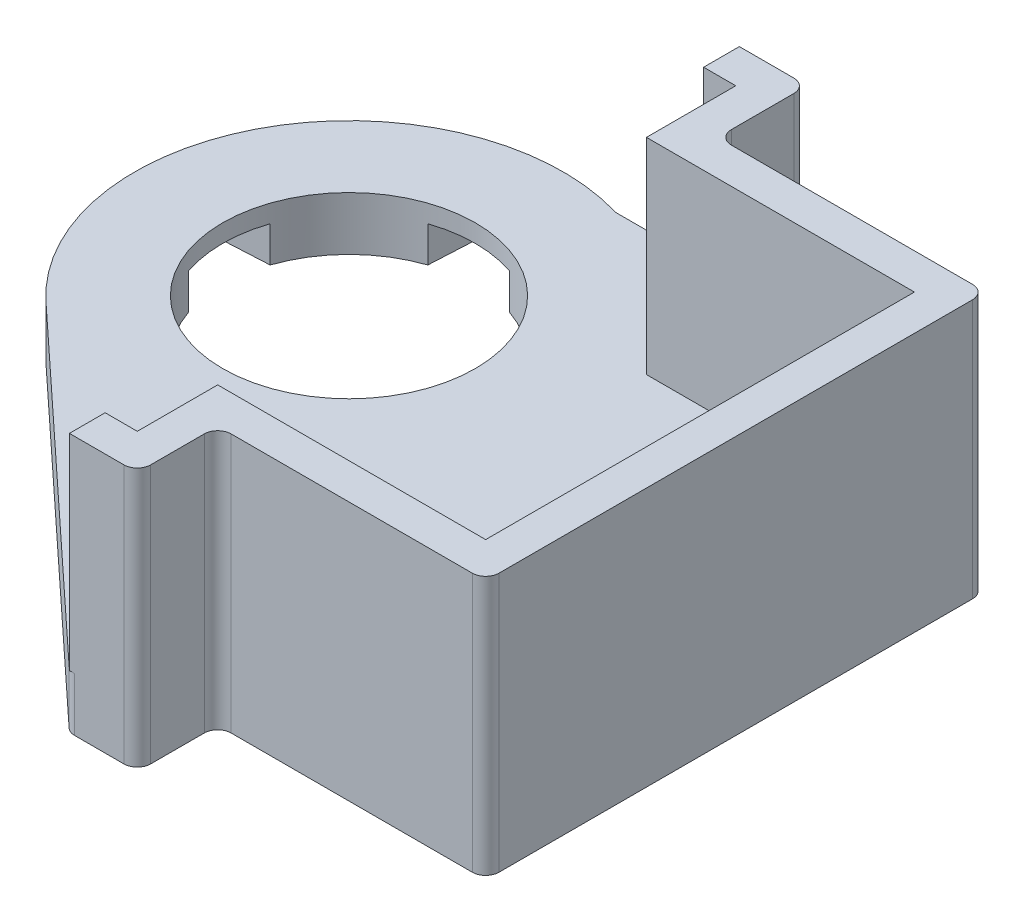
from build123d import *

# Parameters (mm, degrees)
BRACKET_DEPTH       = 11.5
BOSS_EXTRUDE1_START = -3
BOSS_EXTRUDE1_DEPTH = 3
CUT_EXTRUDE1_START  = -3
CUT_EXTRUDE1_DEPTH  = 2
CUT_EXTRUDE2_START  = -2.5
SKETCH15_4_W        = 5
SKETCH15_4_H        = 5
CUT_EXTRUDE2_DEPTH  = 2.5


with BuildPart() as part:
    # Sketch9 → Bracket (new body)
    with BuildSketch(Plane(origin=(0, 0, 0), x_dir=(1, 0, 0), z_dir=(0, 1, 0))):
        with BuildLine():
            Line((5.15, -5), (4.65, -5))
            Line((4.65, -5), (3.35, -5))
            Line((3.35, -5), (3.35, -7))
            Line((3.35, -7), (6.4, -7))
            ThreePointArc((6.4, -7), (6.930330086, -6.780330086), (7.15, -6.25))
            Line((7.15, -6.25), (7.15, -5))
            Line((7.15, -5), (7.15, -3.25))
            ThreePointArc((7.15, -3.25), (7.369669914, -2.719669914), (7.9, -2.5))
            Line((7.9, -2.5), (21.4, -2.5))
            ThreePointArc((21.4, -2.5), (21.930330086, -2.280330086), (22.15, -1.75))
            Line((22.15, -1.75), (22.15, 24.75))
            ThreePointArc((22.15, 24.75), (21.930330086, 25.280330086), (21.4, 25.5))
            Line((21.4, 25.5), (7.9, 25.5))
            ThreePointArc((7.9, 25.5), (7.369669914, 25.719669914), (7.15, 26.25))
            Line((7.15, 26.25), (7.15, 28))
            Line((7.15, 28), (7.15, 29.75))
            ThreePointArc((7.15, 29.75), (6.930330086, 30.280330086), (6.4, 30.5))
            Line((6.4, 30.5), (5.15, 30.5))
            Line((5.15, 30.5), (3.35, 30.5))
            Line((3.35, 30.5), (3.35, 28.5))
            Line((3.35, 28.5), (5.15, 28.5))
            Line((5.15, 28.5), (5.15, 28))
            Line((5.15, 28), (5.15, 23.5))
            Line((5.15, 23.5), (20.15, 23.5))
            Line((20.15, 23.5), (20.15, -0.5))
            Line((20.15, -0.5), (5.15, -0.5))
            Line((5.15, -0.5), (5.15, -5))
        make_face()
    extrude(amount=BRACKET_DEPTH)

    # Sketch12 → Boss-Extrude1 (add)
    with BuildSketch(Plane(origin=(0, 0, 0), x_dir=(1, 0, 0), z_dir=(0, 1, 0)).offset(BOSS_EXTRUDE1_START)):
        with BuildLine():
            Line((3.134136634, -6.799408153), (-15.169112008, 10.208954707))
            ThreePointArc((-15.169112008, 10.208954707), (-17.445237733, 24.907700028), (-3.6745965, 30.529381479))
            ThreePointArc((-3.6745965, 30.529381479), (-3.571695801, 30.507381696), (-3.466728879, 30.5))
            Line((-3.466728879, 30.5), (6.4, 30.5))
            ThreePointArc((6.4, 30.5), (6.930330086, 30.280330086), (7.15, 29.75))
            Line((7.15, 29.75), (7.15, 26.25))
            ThreePointArc((7.15, 26.25), (7.369669914, 25.719669914), (7.9, 25.5))
            Line((7.9, 25.5), (21.4, 25.5))
            ThreePointArc((21.4, 25.5), (21.930330086, 25.280330086), (22.15, 24.75))
            Line((22.15, 24.75), (22.15, -1.75))
            ThreePointArc((22.15, -1.75), (21.930330086, -2.280330086), (21.4, -2.5))
            Line((21.4, -2.5), (7.9, -2.5))
            ThreePointArc((7.9, -2.5), (7.369669914, -2.719669914), (7.15, -3.25))
            Line((7.15, -3.25), (7.15, -6.25))
            ThreePointArc((7.15, -6.25), (6.930330086, -6.780330086), (6.4, -7))
            Line((6.4, -7), (3.644676233, -7))
            ThreePointArc((3.644676233, -7), (3.370410043, -6.948053048), (3.134136634, -6.799408153))
        make_face()
    extrude(amount=BOSS_EXTRUDE1_DEPTH)

    # Sketch15 → Cut-Extrude1 (cut)
    with BuildSketch(Plane(origin=(0, 0, 0), x_dir=(1, 0, 0), z_dir=(0, 1, 0)).offset(CUT_EXTRUDE1_START)):
        with BuildLine():
            Line((-9.279054633, 12.306278316), (-8.999521572, 7.000514852))
            ThreePointArc((-8.999521572, 7.000514852), (-6.999521572, 5.000514852), (-4.999521572, 7.000514852))
            Line((-4.999521572, 7.000514852), (-4.720515244, 12.306424778))
            ThreePointArc((-4.720515244, 12.306424778), (-1.999839357, 14.000160648), (-0.306278316, 16.720945367))
            Line((-0.306278316, 16.720945367), (4.999485148, 17.000478428))
            ThreePointArc((4.999485148, 17.000478428), (6.999485148, 19.000478428), (4.999485148, 21.000478428))
            Line((4.999485148, 21.000478428), (-0.306424778, 21.279484756))
            ThreePointArc((-0.306424778, 21.279484756), (-2.000160648, 24.000160643), (-4.720945367, 25.693721684))
            Line((-4.720945367, 25.693721684), (-5.000478428, 30.999485148))
            ThreePointArc((-5.000478428, 30.999485148), (-7.000478428, 32.999485148), (-9.000478428, 30.999485148))
            Line((-9.000478428, 30.999485148), (-9.279484756, 25.693575222))
            ThreePointArc((-9.279484756, 25.693575222), (-12.000160643, 23.999839352), (-13.693721684, 21.279054633))
            Line((-13.693721684, 21.279054633), (-18.999485148, 20.999521572))
            ThreePointArc((-18.999485148, 20.999521572), (-20.999485148, 18.999521572), (-18.999485148, 16.999521572))
            Line((-18.999485148, 16.999521572), (-13.693575222, 16.720515244))
            ThreePointArc((-13.693575222, 16.720515244), (-11.999839352, 13.999839357), (-9.279054633, 12.306278316))
        make_face()
    extrude(amount=CUT_EXTRUDE1_DEPTH, mode=Mode.SUBTRACT)

    # Sketch15<4> → Cut-Extrude2 (cut)
    with BuildSketch(Plane(origin=(0, 0, 0), x_dir=(1, 0, 0), z_dir=(0, 1, 0)).offset(CUT_EXTRUDE2_START)):
        with BuildLine():
            Line((-13.693721684, 21.279054633), (-9.5, 21.5))
            Line((-9.5, 21.5), (-9.279484756, 25.693575222))
            ThreePointArc((-9.279484756, 25.693575222), (-12.000160643, 23.999839352), (-13.693721684, 21.279054633))
        make_face()
        with BuildLine():
            Line((-9.5, 21.5), (-7.000099677, 21.5))
            Line((-7.000099677, 21.5), (-7.000281928, 26.071067806))
            ThreePointArc((-7.000281928, 26.071067806), (-8.155404343, 25.976033314), (-9.279484756, 25.693575222))
            Line((-9.279484756, 25.693575222), (-9.5, 21.5))
        make_face()
        with BuildLine():
            Line((-7.000099677, 21.5), (-4.5, 21.5))
            Line((-4.5, 21.5), (-4.720945367, 25.693721684))
            ThreePointArc((-4.720945367, 25.693721684), (-5.845097933, 25.976116485), (-7.000281928, 26.071067806))
            Line((-7.000281928, 26.071067806), (-7.000099677, 21.5))
        make_face()
        with BuildLine():
            Line((-4.720945367, 25.693721684), (-4.5, 21.5))
            Line((-4.5, 21.5), (-0.306424778, 21.279484756))
            ThreePointArc((-0.306424778, 21.279484756), (-2.000160648, 24.000160643), (-4.720945367, 25.693721684))
        make_face()
        with BuildLine():
            Line((-0.306278316, 16.720945367), (-4.5, 16.5))
            Line((-4.5, 16.5), (-4.720515244, 12.306424778))
            ThreePointArc((-4.720515244, 12.306424778), (-1.999839357, 14.000160648), (-0.306278316, 16.720945367))
        make_face()
        with BuildLine():
            Line((-0.306424778, 21.279484756), (-4.5, 21.5))
            Line((-4.5, 21.5), (-4.5, 16.5))
            Line((-4.5, 16.5), (-0.306278316, 16.720945367))
            ThreePointArc((-0.306278316, 16.720945367), (-0.023906539, 17.844958862), (0.071067812, 19))
            ThreePointArc((0.071067812, 19), (-0.023943654, 20.155265273), (-0.306424778, 21.279484756))
        make_face()
        with Locations((-7, 19)):
            Rectangle(SKETCH15_4_W, SKETCH15_4_H)
        with BuildLine():
            Line((-4.720515244, 12.306424778), (-4.5, 16.5))
            Line((-4.5, 16.5), (-9.5, 16.5))
            Line((-9.5, 16.5), (-9.279054633, 12.306278316))
            ThreePointArc((-9.279054633, 12.306278316), (-6.999772812, 11.928932192), (-4.720515244, 12.306424778))
        make_face()
        with BuildLine():
            Line((-9.5, 16.5), (-9.5, 21.5))
            Line((-9.5, 21.5), (-13.693721684, 21.279054633))
            ThreePointArc((-13.693721684, 21.279054633), (-14.071067808, 18.999772812), (-13.693575222, 16.720515244))
            Line((-13.693575222, 16.720515244), (-9.5, 16.5))
        make_face()
        with BuildLine():
            Line((-9.279054633, 12.306278316), (-9.5, 16.5))
            Line((-9.5, 16.5), (-13.693575222, 16.720515244))
            ThreePointArc((-13.693575222, 16.720515244), (-11.999839352, 13.999839357), (-9.279054633, 12.306278316))
        make_face()
    extrude(amount=CUT_EXTRUDE2_DEPTH, mode=Mode.SUBTRACT)


solid = part.part
